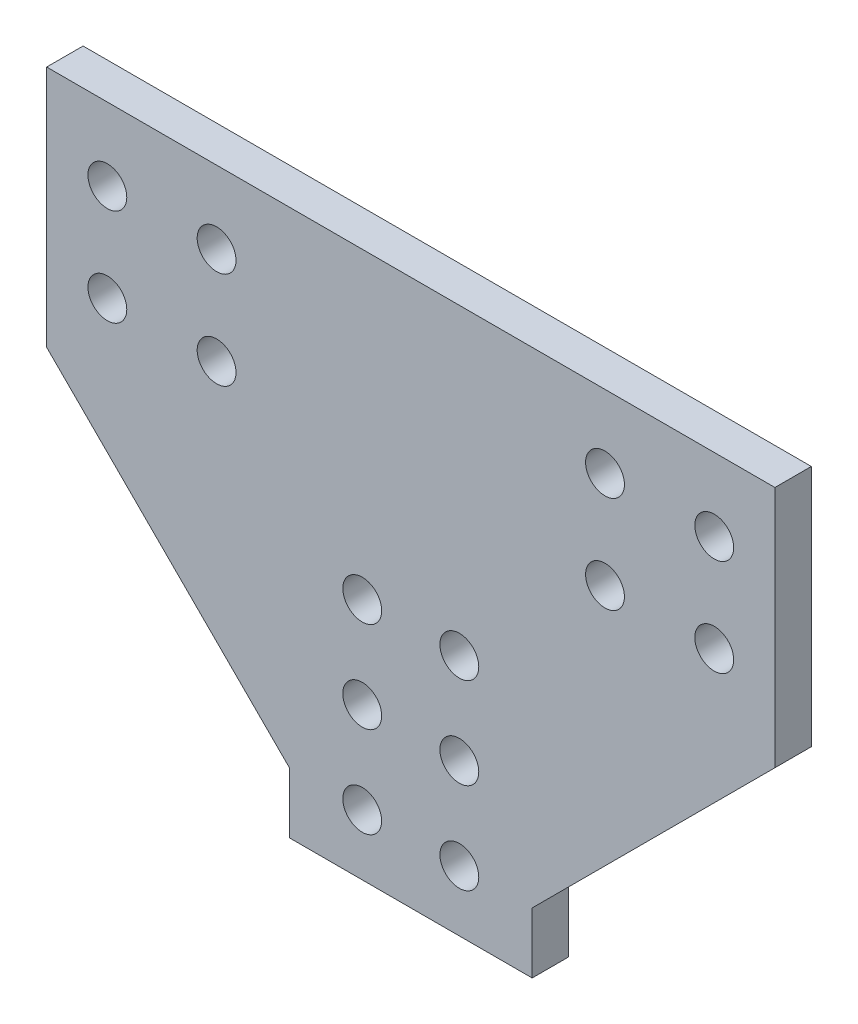
from build123d import *

# Parameters (mm, degrees)
EXTRUDE_1_DEPTH     = 3
SKETCH_3_R          = 1.6
CUT_EXTRUDE_1_DEPTH = 3


with BuildPart() as part:
    # 草图1 → 凸台-拉伸1 (new body)
    with BuildSketch(Plane.XY):
        Polygon((0, 0), (0, 20), (60, 20), (60, 0), (40, -20), (40, -25), (20, -25), (20, -20), align=None)
    extrude(amount=EXTRUDE_1_DEPTH)

    # 草图3 → 切除-拉伸1 (cut)
    with BuildSketch(Plane.XY.offset(3)):
        with Locations((26, -5)):
            Circle(SKETCH_3_R)
        with Locations((34, -5)):
            Circle(SKETCH_3_R)
        with Locations((26, -20)):
            Circle(SKETCH_3_R)
        with Locations((34, -20)):
            Circle(SKETCH_3_R)
        with Locations((26, -12.5)):
            Circle(SKETCH_3_R)
        with Locations((34, -12.5)):
            Circle(SKETCH_3_R)
        with Locations((5, 14)):
            Circle(SKETCH_3_R)
        with Locations((5, 6)):
            Circle(SKETCH_3_R)
        with Locations((14, 14)):
            Circle(SKETCH_3_R)
        with Locations((14, 6)):
            Circle(SKETCH_3_R)
        with Locations((55, 14)):
            Circle(SKETCH_3_R)
        with Locations((55, 6)):
            Circle(SKETCH_3_R)
        with Locations((46, 14)):
            Circle(SKETCH_3_R)
        with Locations((46, 6)):
            Circle(SKETCH_3_R)
    extrude(amount=-CUT_EXTRUDE_1_DEPTH, mode=Mode.SUBTRACT)


solid = part.part
